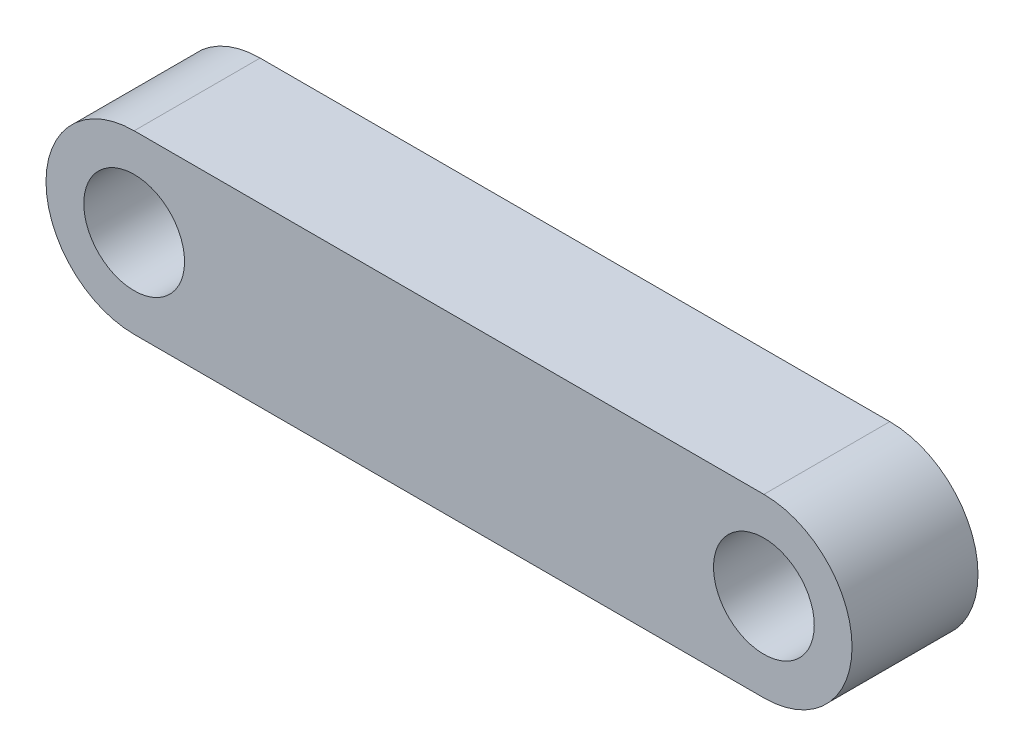
from build123d import *

# Parameters (mm, degrees)
SKETCH1_R           = 2
BOSS_EXTRUDE1_DEPTH = 5


with BuildPart() as part:
    # Sketch1 → Boss-Extrude1 (new body)
    with BuildSketch(Plane.XY):
        with BuildLine():
            Line((-12.5, -3.5), (12.5, -3.5))
            ThreePointArc((12.5, -3.5), (16, 0), (12.5, 3.5))
            Line((12.5, 3.5), (-12.5, 3.5))
            ThreePointArc((-12.5, 3.5), (-16, 0), (-12.5, -3.5))
        make_face()
        with Locations((12.5, 0)):
            Circle(SKETCH1_R, mode=Mode.SUBTRACT)
        with Locations((-12.5, 0)):
            Circle(SKETCH1_R, mode=Mode.SUBTRACT)
    extrude(amount=BOSS_EXTRUDE1_DEPTH)


solid = part.part
